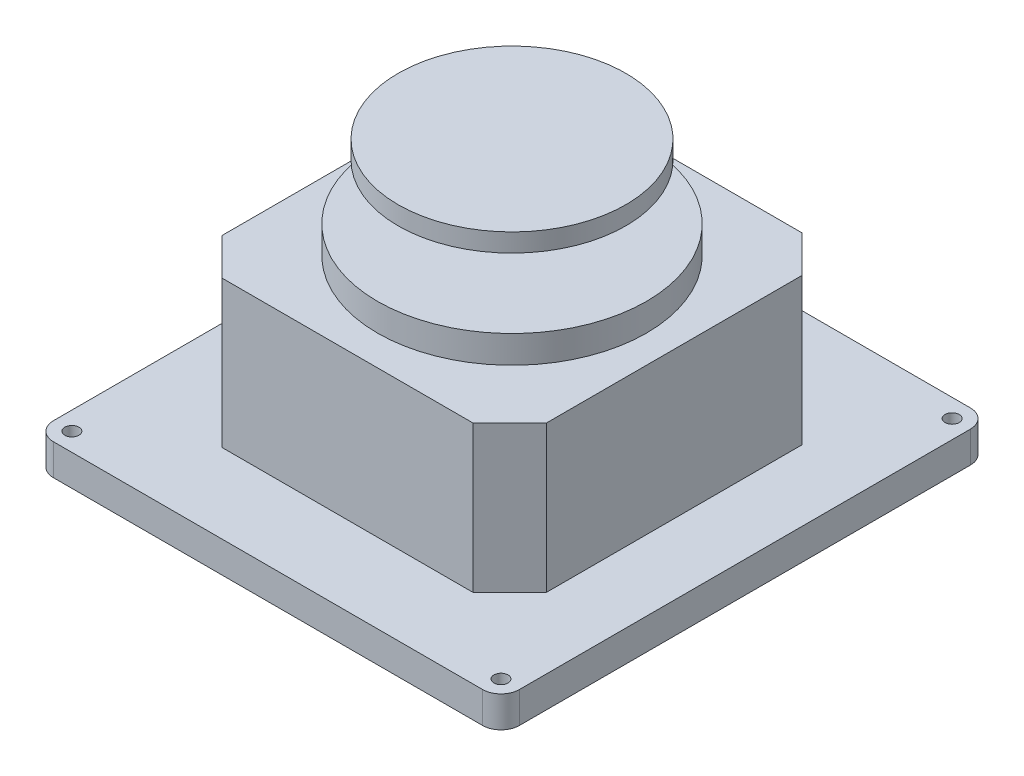
from build123d import *

# Parameters (mm, degrees)
ESQUISSE1_W                                = 17.7
ESQUISSE1_H                                = 17.95
BOSS_EXTRU_1_DEPTH                         = 8
ENL_V_MAT_EXTRU_1_DEPTH                    = 8
SYM_TRIE1_AT_THE_SECOND_PLANE_COPY_1_DEPTH = 8
ESQUISSE4_R                                = 7.334991569
BOSS_EXTRU_2_DEPTH                         = 1.5
ESQUISSE5_R                                = 1.475
BOSS_EXTRU_3_DEPTH                         = 3
ESQUISSE6_R                                = 6.208536563
BOSS_EXTRU_4_DEPTH                         = 1
ESQUISSE7_W                                = 25.4
ESQUISSE7_H                                = 26.6
BOSS_EXTRU_5_DEPTH                         = 1.7
CONG_1_R                                   = 1
CONG_2_R                                   = 1
ESQUISSE8_R                                = 0.384895333
ENL_V_MAT_EXTRU_2_DEPTH                    = 1.7
SYM_TRIE5_AT_THE_SECOND_PLANE_COPY_1_SKE_R = 0.384895333
SYM_TRIE5_AT_THE_SECOND_PLANE_COPY_1_DEPTH = 1.7


with BuildPart() as part:
    # Esquisse1 → Boss.-Extru.1 (new body)
    with BuildSketch(Plane(origin=(0, 0, 0), x_dir=(1, 0, 0), z_dir=(0, 1, 0))):
        Rectangle(ESQUISSE1_W, ESQUISSE1_H)
    extrude(amount=BOSS_EXTRU_1_DEPTH)

    # Esquisse2 → Enlèv. mat.-Extru.1 (cut)
    with BuildSketch(Plane(origin=(0, 8, 0), x_dir=(1, 0, 0), z_dir=(0, 1, 0))):
        Polygon((-8.85, -6.975), (-6.85, -8.975), (-8.85, -8.975), align=None)
    enl_v_mat_extru_1 = extrude(amount=-ENL_V_MAT_EXTRU_1_DEPTH, mode=Mode.SUBTRACT)

    # Symétrie1: Enlèv. mat.-Extru.1 across plane
    add(enl_v_mat_extru_1.mirror(Plane.XY), mode=Mode.SUBTRACT)

    # Symétrie1 at the second plane: Enlèv. mat.-Extru.1 across plane
    add(enl_v_mat_extru_1.mirror(Plane(origin=(0, 0, 0), x_dir=(0, 0, 1), z_dir=(1, 0, 0))), mode=Mode.SUBTRACT)

    # Symétrie1 at the second plane copy 1 ske → Symétrie1 at the second plane copy 1 (cut)
    with BuildSketch(Plane(origin=(0, 8, 0), x_dir=(-1, 0, 0), z_dir=(0, 1, 0))):
        Polygon((-8.85, -6.975), (-6.85, -8.975), (-8.85, -8.975), align=None)
    extrude(amount=-SYM_TRIE1_AT_THE_SECOND_PLANE_COPY_1_DEPTH, mode=Mode.SUBTRACT)

    # Esquisse4 → Boss.-Extru.2 (add)
    with BuildSketch(Plane(origin=(0, 8, 0), x_dir=(1, 0, 0), z_dir=(0, 1, 0))):
        with Locations(Location((0, 0, 0), (0, 0, 270))):
            Circle(ESQUISSE4_R)
    extrude(amount=BOSS_EXTRU_2_DEPTH)

    # Esquisse5 → Boss.-Extru.3 (add)
    with BuildSketch(Plane(origin=(0, 9.5, 0), x_dir=(1, 0, 0), z_dir=(0, 1, 0))):
        with Locations(Location((0, 0, 0), (0, 0, 270))):
            Circle(ESQUISSE5_R)
    extrude(amount=BOSS_EXTRU_3_DEPTH)

    # Esquisse6 → Boss.-Extru.4 (add)
    with BuildSketch(Plane(origin=(0, 12.5, 0), x_dir=(1, 0, 0), z_dir=(0, 1, 0))):
        with Locations(Location((0, 0, 0), (0, 0, 270))):
            Circle(ESQUISSE6_R)
    extrude(amount=BOSS_EXTRU_4_DEPTH)

    # Esquisse7 → Boss.-Extru.5 (add)
    with BuildSketch(Plane.XZ):
        Rectangle(ESQUISSE7_W, ESQUISSE7_H)
    extrude(amount=BOSS_EXTRU_5_DEPTH)

    # Congé1
    cong_1_edges = [part.edges().sort_by_distance(p)[0] for p in [
        (12.7, -0.85, 13.3),
    ]]
    fillet(cong_1_edges, radius=CONG_1_R)

    # Congé2
    cong_2_edges = [part.edges().sort_by_distance(p)[0] for p in [
        (12.7, -0.85, -13.3),
        (-12.7, -0.85, 13.3),
        (-12.7, -0.85, -13.3),
    ]]
    fillet(cong_2_edges, radius=CONG_2_R)

    # Esquisse8 → Enlèv. mat.-Extru.2 (cut)
    with BuildSketch(Plane.XZ.offset(1.7)):
        with Locations(Location((-11.7, -12.3, 0), (0, 0, 270))):
            Circle(ESQUISSE8_R)
    enl_v_mat_extru_2 = extrude(amount=-ENL_V_MAT_EXTRU_2_DEPTH, mode=Mode.SUBTRACT)

    # Symétrie5: Enlèv. mat.-Extru.2 across plane
    add(enl_v_mat_extru_2.mirror(Plane.XY), mode=Mode.SUBTRACT)

    # Symétrie5 at the second plane: Enlèv. mat.-Extru.2 across plane
    add(enl_v_mat_extru_2.mirror(Plane(origin=(0, 0, 0), x_dir=(0, 0, 1), z_dir=(1, 0, 0))), mode=Mode.SUBTRACT)

    # Symétrie5 at the second plane copy 1 ske → Symétrie5 at the second plane copy 1 (cut)
    with BuildSketch(Plane(origin=(0, -1.7, 0), x_dir=(-1, 0, 0), z_dir=(0, -1, 0))):
        with Locations(Location((-11.7, -12.3, 0), (0, 0, 270))):
            Circle(SYM_TRIE5_AT_THE_SECOND_PLANE_COPY_1_SKE_R)
    extrude(amount=-SYM_TRIE5_AT_THE_SECOND_PLANE_COPY_1_DEPTH, mode=Mode.SUBTRACT)


solid = part.part
